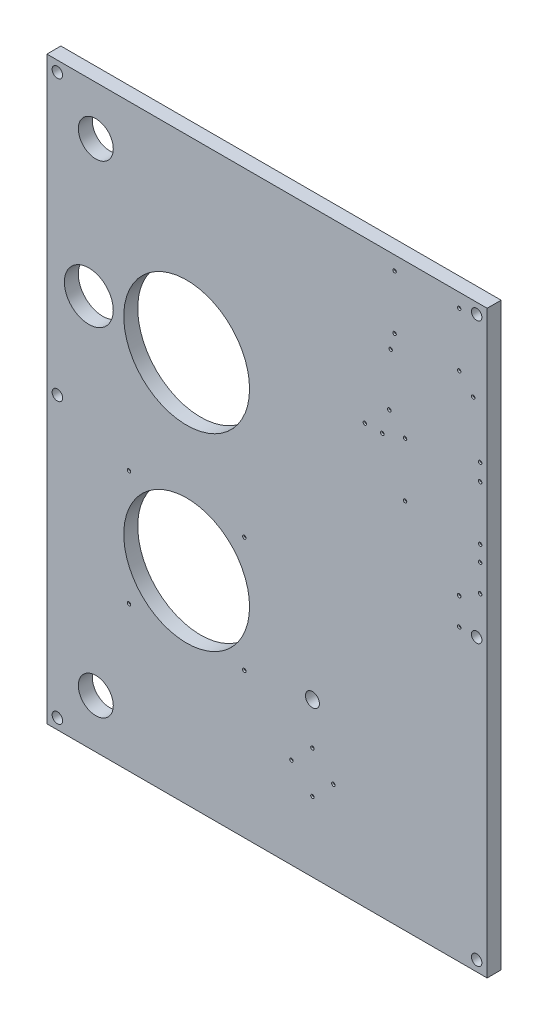
from build123d import *

# Parameters (mm, degrees)
SKETCH2_W           = 400.05
SKETCH2_H           = 527.05
SKETCH2_R           = 4.7625
BOSS_EXTRUDE1_DEPTH = 12.7
SKETCH3_R           = 15.875
SKETCH3_R_2         = 22.225
SKETCH3_R_3         = 57.15
CUT_EXTRUDE1_DEPTH  = 332.084152822
SKETCH4_R           = 1.5875
CUT_EXTRUDE2_DEPTH  = 1.5875
SKETCH7_R           = 6.35
CUT_EXTRUDE4_DEPTH  = 332.084152822


with BuildPart() as part:
    # Sketch2 → Boss-Extrude1 (new body)
    with BuildSketch(Plane.XY):
        Rectangle(SKETCH2_W, SKETCH2_H)
        with Locations((-190.5, 254)):
            Circle(SKETCH2_R, mode=Mode.SUBTRACT)
        with Locations((190.5, 254)):
            Circle(SKETCH2_R, mode=Mode.SUBTRACT)
        with Locations((-190.5, -254)):
            Circle(SKETCH2_R, mode=Mode.SUBTRACT)
        with Locations((190.5, -254)):
            Circle(SKETCH2_R, mode=Mode.SUBTRACT)
        with Locations((-190.5, 0)):
            Circle(SKETCH2_R, mode=Mode.SUBTRACT)
        with Locations((190.5, 0)):
            Circle(SKETCH2_R, mode=Mode.SUBTRACT)
    extrude(amount=BOSS_EXTRUDE1_DEPTH)

    # Sketch3 → Cut-Extrude1 (cut, through all)
    with BuildSketch(Plane.XY.offset(12.7)):
        with Locations((-155.575, 219.075)):
            Circle(SKETCH3_R)
        with Locations((-161.925, 92.075)):
            Circle(SKETCH3_R_2)
        with Locations((-73.025, 92.075)):
            Circle(SKETCH3_R_3)
        with Locations((-73.025, -79.375)):
            Circle(SKETCH3_R_3)
        with Locations((-155.575, -219.075)):
            Circle(SKETCH3_R)
    extrude(amount=-CUT_EXTRUDE1_DEPTH, mode=Mode.SUBTRACT)

    # Sketch4 → Cut-Extrude2 (cut)
    with BuildSketch(Plane.XY.offset(12.7)):
        with Locations((60.325, -180.975)):
            Circle(SKETCH4_R)
        with Locations((22.225, -180.975)):
            Circle(SKETCH4_R)
        with Locations((41.275, -161.925)):
            Circle(SKETCH4_R)
        with Locations((193.675, 35.71875)):
            Circle(SKETCH4_R)
        with Locations((174.625, 0)):
            Circle(SKETCH4_R)
        with Locations((193.675, 60.325)):
            Circle(SKETCH4_R)
        with Locations((193.675, 74.6125)):
            Circle(SKETCH4_R)
        with Locations((193.675, 123.825)):
            Circle(SKETCH4_R)
        with Locations((125.4125, 123.825)):
            Circle(SKETCH4_R)
        with Locations((125.4125, 74.6125)):
            Circle(SKETCH4_R)
        with Locations((88.9, 117.475)):
            Circle(SKETCH4_R)
        with Locations((104.775, 117.475)):
            Circle(SKETCH4_R)
        with Locations((115.8875, 250.825)):
            Circle(SKETCH4_R)
        with Locations((174.625, 250.825)):
            Circle(SKETCH4_R)
        with Locations((174.625, 201.6125)):
            Circle(SKETCH4_R)
        with Locations((115.8875, 201.6125)):
            Circle(SKETCH4_R)
        with Locations((112.395, 187.325)):
            Circle(SKETCH4_R)
        with Locations((187.325, 187.325)):
            Circle(SKETCH4_R)
        with Locations((111.125, 139.065)):
            Circle(SKETCH4_R)
        with Locations((193.675, 139.065)):
            Circle(SKETCH4_R)
        with Locations((41.275, -200.025)):
            Circle(SKETCH4_R)
        with Locations((174.625, 24.60625)):
            Circle(SKETCH4_R)
        with Locations((-125.4125, -26.9875)):
            Circle(SKETCH4_R)
        with Locations((-20.6375, -26.9875)):
            Circle(SKETCH4_R)
        with Locations((-20.6375, -131.7625)):
            Circle(SKETCH4_R)
        with Locations((-125.4125, -131.7625)):
            Circle(SKETCH4_R)
    extrude(amount=-CUT_EXTRUDE2_DEPTH, mode=Mode.SUBTRACT)

    # Sketch7 → Cut-Extrude4 (cut, through all)
    with BuildSketch(Plane.XY.offset(12.7)):
        with Locations((41.275, -123.825)):
            Circle(SKETCH7_R)
    extrude(amount=-CUT_EXTRUDE4_DEPTH, mode=Mode.SUBTRACT)


solid = part.part
